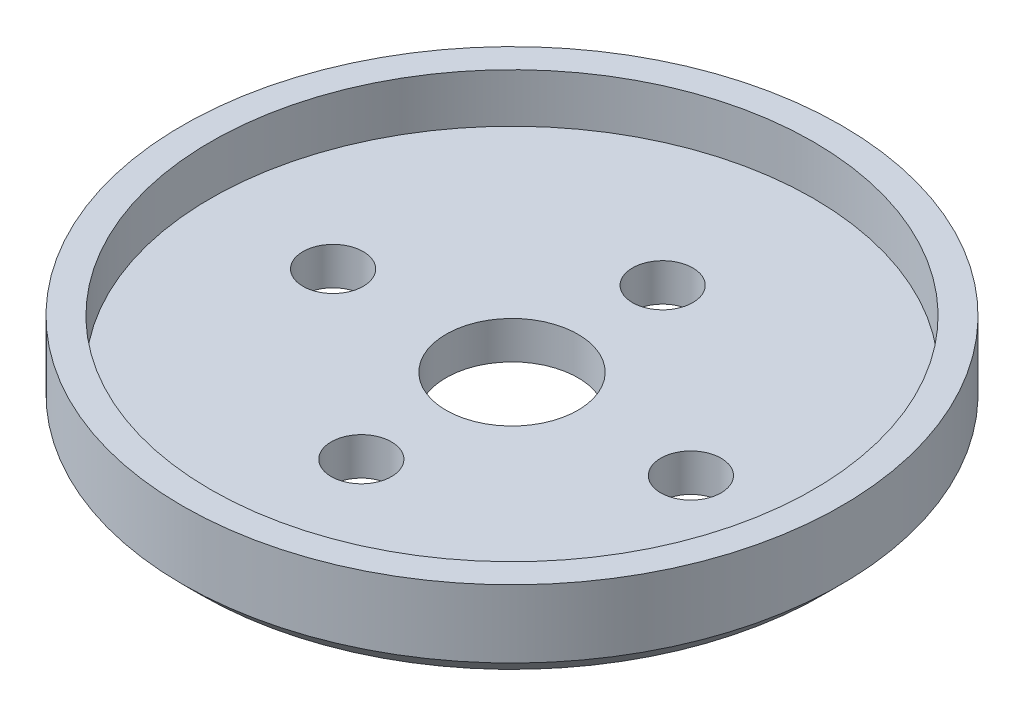
from build123d import *

# Parameters (mm, degrees)
SKETCH1_R           = 17.5
SKETCH1_R_2         = 3.5
BOSS_EXTRUDE1_DEPTH = 2
SKETCH10_R          = 17.5
SKETCH10_R_2        = 16
BOSS_EXTRUDE4_DEPTH = 2.6
SKETCH2_R           = 1.6
CUT_EXTRUDE1_DEPTH  = 3
CHAMFER2_SIZE       = 1


with BuildPart() as part:
    # Sketch1 → Boss-Extrude1 (new body)
    with BuildSketch(Plane(origin=(0, 0, 0), x_dir=(1, 0, 0), z_dir=(0, 1, 0))):
        with Locations(Location((0, 0, 0), (0, 0, 270))):
            Circle(SKETCH1_R)
        with Locations(Location((0, 0, 0), (0, 0, 270))):
            Circle(SKETCH1_R_2, mode=Mode.SUBTRACT)
    extrude(amount=BOSS_EXTRUDE1_DEPTH)

    # Sketch10 → Boss-Extrude4 (add)
    with BuildSketch(Plane(origin=(0, 2, 0), x_dir=(1, 0, 0), z_dir=(0, 1, 0))):
        with Locations(Location((0, 0, 0), (0, 0, 270))):
            Circle(SKETCH10_R)
        with Locations(Location((0, 0, 0), (0, 0, 270))):
            Circle(SKETCH10_R_2, mode=Mode.SUBTRACT)
    extrude(amount=BOSS_EXTRUDE4_DEPTH)

    # Sketch2 → Cut-Extrude1 (cut)
    with BuildSketch(Plane(origin=(0, 2, 0), x_dir=(1, 0, 0), z_dir=(0, 1, 0))):
        with Locations(Location((-9.5, 0, 0), (0, 0, 270))):
            Circle(SKETCH2_R)
        with Locations(Location((0, 8, 0), (0, 0, 270))):
            Circle(SKETCH2_R)
        with Locations(Location((0, -8, 0), (0, 0, 270))):
            Circle(SKETCH2_R)
        with Locations(Location((9.5, 0, 0), (0, 0, 270))):
            Circle(SKETCH2_R)
    extrude(amount=-CUT_EXTRUDE1_DEPTH, mode=Mode.SUBTRACT)

    # Chamfer2
    chamfer2_edges = [part.edges().sort_by_distance(p)[0] for p in [
        (0, 0, -17.5),
    ]]
    chamfer(chamfer2_edges, length=CHAMFER2_SIZE)


solid = part.part
